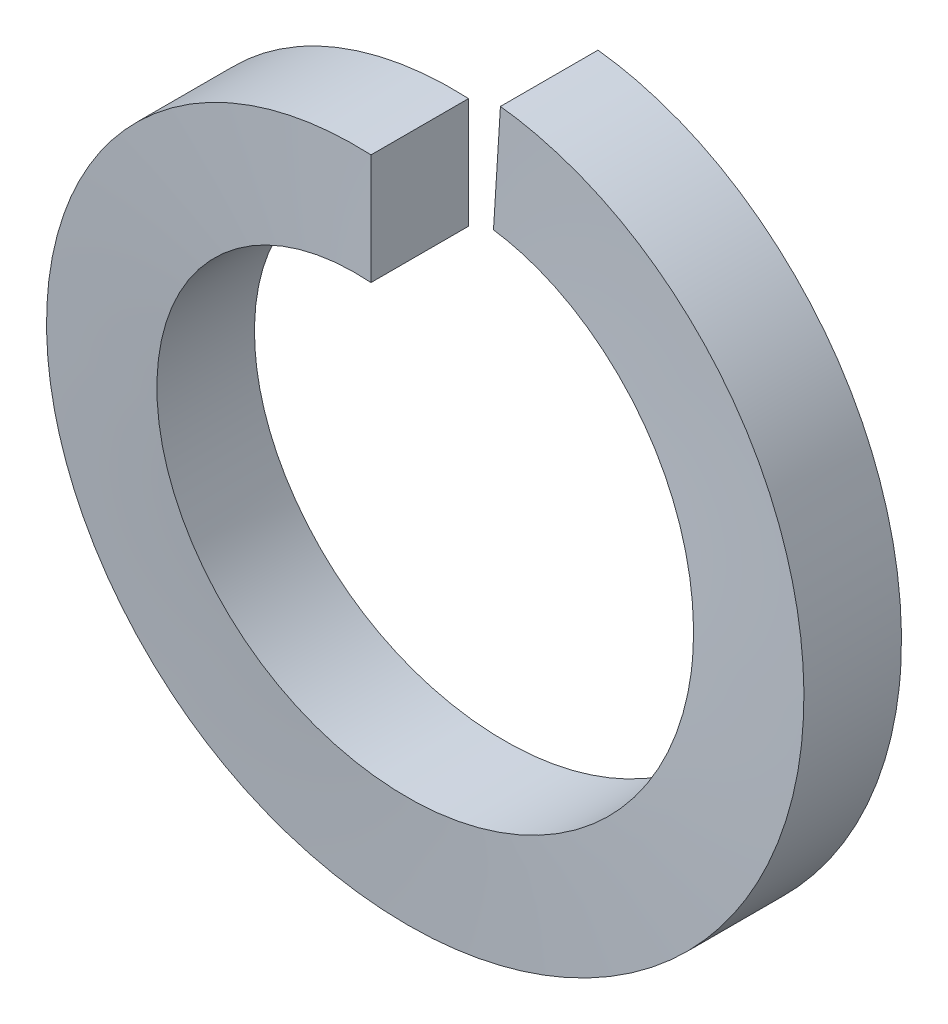
from build123d import *

# Parameters (mm, degrees)
SWEEP1_PITCH       = 0.846666667
SWEEP1_HEIGHT      = 0.8382
SWEEP1_RADIUS      = 2.7432
SWEEP1_START_ANGLE = 90
SKETCH2_W          = 0.762
SKETCH2_H          = 0.8636


with BuildPart() as part:
    # Sweep1: sweep along a helix
    with BuildLine() as sweep1_path:
        add(Helix(SWEEP1_PITCH, SWEEP1_HEIGHT, SWEEP1_RADIUS, center=(0, 0, 0), direction=(0, 0, -1), lefthand=True, mode=Mode.PRIVATE).rotate(Axis((0, 0, 0), (0, 0, -1)), SWEEP1_START_ANGLE))
    # Sketch2 → Sweep1 (sweep)
    with BuildSketch(Plane(origin=(0, 0, 0), x_dir=(0, 0, -1), z_dir=(1, 0, 0))):
        with Locations((-0.381, 2.3114)):
            Rectangle(SKETCH2_W, SKETCH2_H)
    sweep(path=sweep1_path.line, is_frenet=True)


solid = part.part
